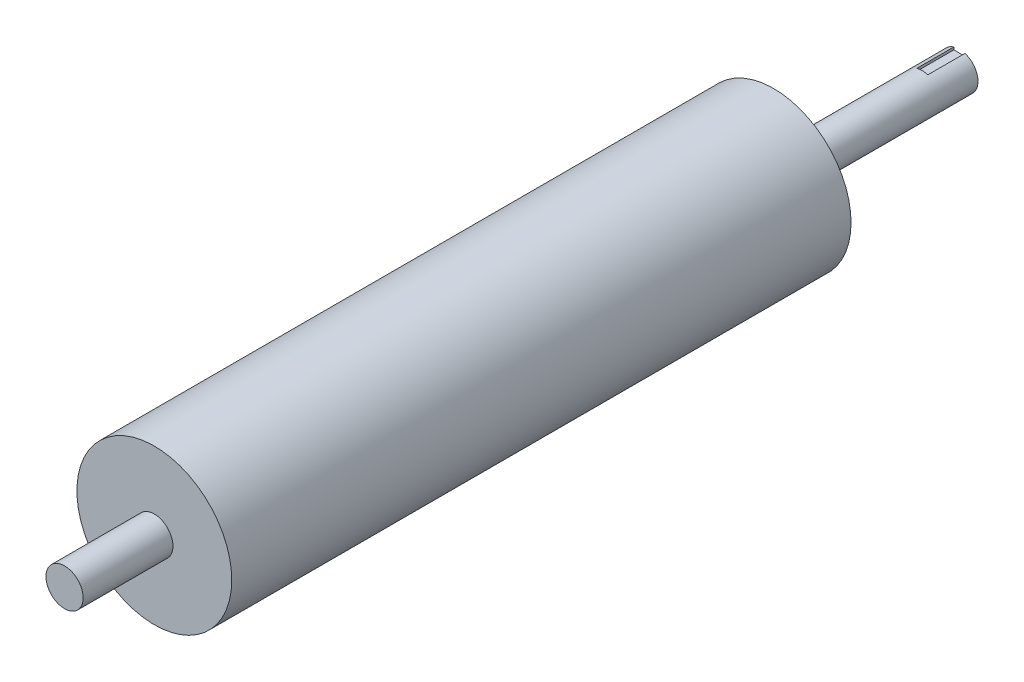
from build123d import *

# Parameters (mm, degrees)
SKETCH2_R           = 125
BOSS_EXTRUDE1_DEPTH = 1000
SKETCH7_R           = 30
BOSS_EXTRUDE3_DEPTH = 145
BOSS_EXTRUDE4_START = 300
SKETCH8_R           = 30
BOSS_EXTRUDE4_DEPTH = 300
SKETCH9_W           = 18
SKETCH9_H           = 11
CUT_EXTRUDE1_DEPTH  = 60


with BuildPart() as part:
    # Sketch2 → Boss-Extrude1 (new body)
    with BuildSketch(Plane.XY):
        Circle(SKETCH2_R)
    extrude(amount=BOSS_EXTRUDE1_DEPTH)

    # Sketch7 → Boss-Extrude3 (add)
    with BuildSketch(Plane.XY.offset(1000)):
        Circle(SKETCH7_R)
    extrude(amount=BOSS_EXTRUDE3_DEPTH)

    # Sketch8 → Boss-Extrude4 (add)
    with BuildSketch(Plane(origin=(0, 0, 0), x_dir=(-1, 0, 0), z_dir=(0, 0, -1)).offset(BOSS_EXTRUDE4_START)):
        with Locations(Location((0, 0, 0), (0, 0, 180))):
            Circle(SKETCH8_R)
    extrude(amount=-BOSS_EXTRUDE4_DEPTH)

    # Sketch9 → Cut-Extrude1 (cut)
    with BuildSketch(Plane(origin=(0, 0, -300), x_dir=(-1, 0, 0), z_dir=(0, 0, -1))):
        with Locations((0, 30)):
            Rectangle(SKETCH9_W, SKETCH9_H)
    extrude(amount=-CUT_EXTRUDE1_DEPTH, mode=Mode.SUBTRACT)


solid = part.part
